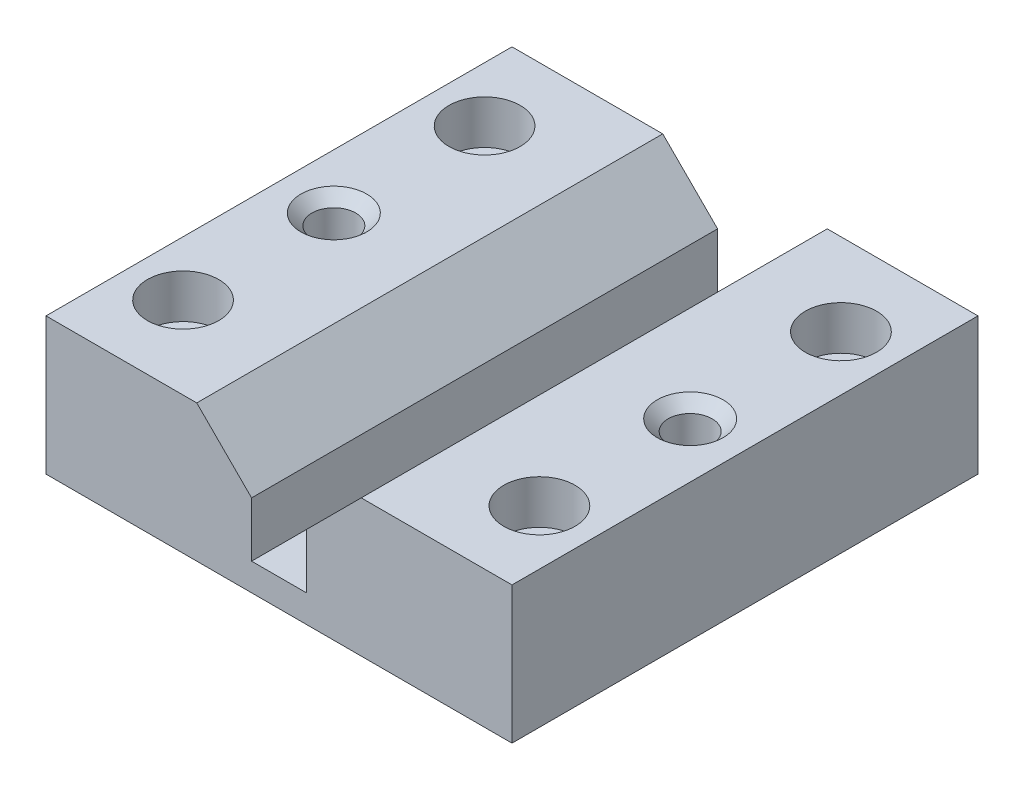
from build123d import *

# Parameters (mm, degrees)
EXTRUDE_1_DEPTH     = 42.5
SKETCH_2_R          = 6.5
CUT_EXTRUDE_1_DEPTH = 8
SKETCH_3_R          = 4
CUT_EXTRUDE_2_DEPTH = 66.096082831
CHAMFER_1_SIZE      = 2


with BuildPart() as part:
    # Эскиз1 → Бобышка-Вытянуть1 (new, symmetric)
    with BuildSketch(Plane.XY):
        Polygon((42.5, 0), (-42.5, 0), (-42.5, 25), (-15, 25), (-5, 15), (-5, 5), (5, 5), (5, 15), (15, 25), (42.5, 25), align=None)
    extrude(amount=EXTRUDE_1_DEPTH, both=True)

    # Эскиз2 → Вырез-Вытянуть1 (cut)
    with BuildSketch(Plane(origin=(0, 25, 0), x_dir=(1, 0, 0), z_dir=(0, 1, 0))):
        with Locations(Location((-32.5, 27.5, 0), (0, 0, 270))):
            Circle(SKETCH_2_R)
        with Locations(Location((-32.5, -27.5, 0), (0, 0, 270))):
            Circle(SKETCH_2_R)
        with Locations(Location((32.5, -27.5, 0), (0, 0, 270))):
            Circle(SKETCH_2_R)
        with Locations(Location((32.5, 27.5, 0), (0, 0, 270))):
            Circle(SKETCH_2_R)
    extrude(amount=-CUT_EXTRUDE_1_DEPTH, mode=Mode.SUBTRACT)

    # Эскиз3 → Вырез-Вытянуть2 (cut, through all)
    with BuildSketch(Plane(origin=(0, 25, 0), x_dir=(1, 0, 0), z_dir=(0, 1, 0))):
        with Locations(Location((-32.5, 0, 0), (0, 0, 270))):
            Circle(SKETCH_3_R)
        with Locations(Location((-32.5, 27.5, 0), (0, 0, 270))):
            Circle(SKETCH_3_R)
        with Locations(Location((32.5, 27.5, 0), (0, 0, 270))):
            Circle(SKETCH_3_R)
        with Locations(Location((32.5, 0, 0), (0, 0, 270))):
            Circle(SKETCH_3_R)
        with Locations(Location((32.5, -27.5, 0), (0, 0, 270))):
            Circle(SKETCH_3_R)
        with Locations(Location((-32.5, -27.5, 0), (0, 0, 270))):
            Circle(SKETCH_3_R)
    extrude(amount=-CUT_EXTRUDE_2_DEPTH, mode=Mode.SUBTRACT)

    # Фаска1
    chamfer_1_edges = [part.edges().sort_by_distance(p)[0] for p in [
        (-32.5, 25, -4),
        (32.5, 25, -4),
    ]]
    chamfer(chamfer_1_edges, length=CHAMFER_1_SIZE)


solid = part.part
